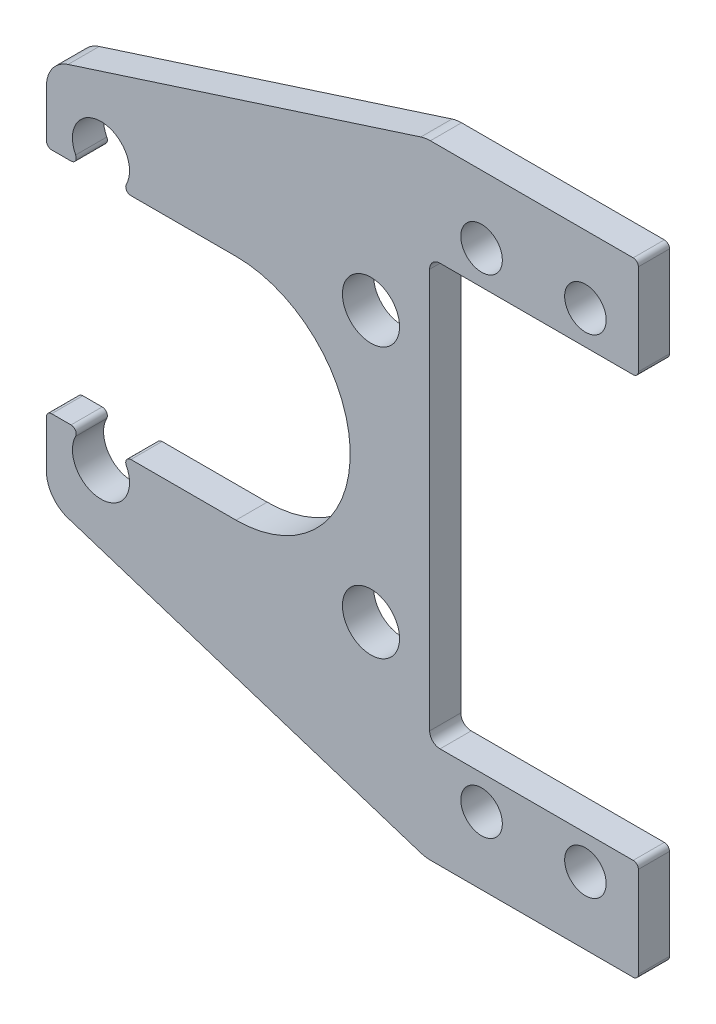
from build123d import *

# Parameters (mm, degrees)
SKETCH1_R           = 2.75
SKETCH1_R_2         = 2
BOSS_EXTRUDE1_DEPTH = 3


with BuildPart() as part:
    # Sketch1 → Boss-Extrude1 (new body)
    with BuildSketch(Plane(origin=(0, 0, 0), x_dir=(0, 1, 0), z_dir=(0, 0, 1))):
        with BuildLine():
            Line((-16.064138017, 18.25), (-11.5, 18.25))
            ThreePointArc((-11.5, 18.25), (-11.146446609, 18.103553391), (-11, 17.75))
            Line((-11, 17.75), (-11, 15.883140649))
            ThreePointArc((-11, 15.883140649), (-11.240562739, 15.455715442), (-11.730769231, 15.439580549))
            ThreePointArc((-11.730769231, 15.439580549), (-15.75, 13), (-11.730769231, 10.560419451))
            ThreePointArc((-11.730769231, 10.560419451), (-11.240562739, 10.544284558), (-11, 10.116859351))
            Line((-11, 10.116859351), (-11, 0))
            ThreePointArc((-11, 0), (0, -11), (11, 0))
            Line((11, 0), (11, 10.116859351))
            ThreePointArc((11, 10.116859351), (11.240562739, 10.544284558), (11.730769231, 10.560419451))
            ThreePointArc((11.730769231, 10.560419451), (15.75, 13), (11.730769231, 15.439580549))
            ThreePointArc((11.730769231, 15.439580549), (11.240562739, 15.455715442), (11, 15.883140649))
            Line((11, 15.883140649), (11, 17.75))
            ThreePointArc((11, 17.75), (11.146446609, 18.103553391), (11.5, 18.25))
            Line((11.5, 18.25), (16.064138017, 18.25))
            ThreePointArc((16.064138017, 18.25), (17.830790051, 17.674652674), (18.919816403, 16.169293727))
            Line((18.919816403, 16.169293727), (29.855678386, -17.801681794))
            ThreePointArc((29.855678386, -17.801681794), (29.963699981, -18.255698807), (30, -18.720975521))
            Line((30, -18.720975521), (30, -38.25))
            ThreePointArc((30, -38.25), (29.853553391, -38.603553391), (29.5, -38.75))
            Line((29.5, -38.75), (20.75, -38.75))
            ThreePointArc((20.75, -38.75), (20.396446609, -38.603553391), (20.25, -38.25))
            Line((20.25, -38.25), (20.25, -19.65))
            ThreePointArc((20.25, -19.65), (19.957106781, -18.942893219), (19.25, -18.65))
            Line((19.25, -18.65), (-19.25, -18.65))
            ThreePointArc((-19.25, -18.65), (-19.957106781, -18.942893219), (-20.25, -19.65))
            Line((-20.25, -19.65), (-20.25, -38.25))
            ThreePointArc((-20.25, -38.25), (-20.396446609, -38.603553391), (-20.75, -38.75))
            Line((-20.75, -38.75), (-29.5, -38.75))
            ThreePointArc((-29.5, -38.75), (-29.853553391, -38.603553391), (-30, -38.25))
            Line((-30, -38.25), (-30, -18.720975521))
            ThreePointArc((-30, -18.720975521), (-29.963699981, -18.255698807), (-29.855678386, -17.801681794))
            Line((-29.855678386, -17.801681794), (-18.919816403, 16.169293727))
            ThreePointArc((-18.919816403, 16.169293727), (-17.830790051, 17.674652674), (-16.064138017, 18.25))
        make_face()
        with Locations(Location((13, -13, 0), (0, 0, 270))):
            Circle(SKETCH1_R, mode=Mode.SUBTRACT)
        with Locations(Location((-13, -13, 0), (0, 0, 270))):
            Circle(SKETCH1_R, mode=Mode.SUBTRACT)
        with Locations(Location((-23.5, -23.65, 0), (0, 0, 270))):
            Circle(SKETCH1_R_2, mode=Mode.SUBTRACT)
        with Locations(Location((23.5, -23.65, 0), (0, 0, 270))):
            Circle(SKETCH1_R_2, mode=Mode.SUBTRACT)
        with Locations(Location((23.5, -33.65, 0), (0, 0, 270))):
            Circle(SKETCH1_R_2, mode=Mode.SUBTRACT)
        with Locations(Location((-23.5, -33.65, 0), (0, 0, 270))):
            Circle(SKETCH1_R_2, mode=Mode.SUBTRACT)
    extrude(amount=BOSS_EXTRUDE1_DEPTH)


solid = part.part
